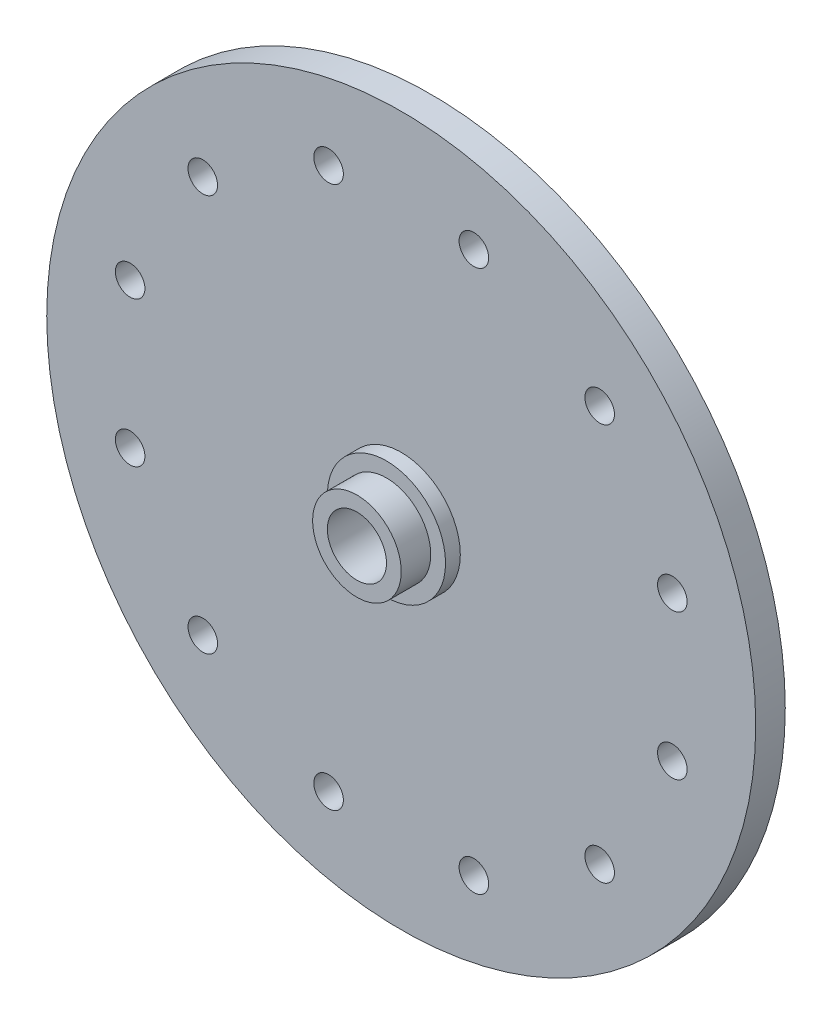
from build123d import *

# Parameters (mm, degrees)
SKETCH2_R           = 152.4
SKETCH2_R_2         = 12.7
BOSS_EXTRUDE1_DEPTH = 12.7
SKETCH3_R           = 6.35
CUT_EXTRUDE1_DEPTH  = 216.9
CRVPATTERN1_COUNT   = 12
SKETCH5_R           = 19.05
BOSS_EXTRUDE2_DEPTH = 19.05
SKETCH6_R           = 25.4
BOSS_EXTRUDE3_DEPTH = 6.35
SKETCH8_R           = 12.7
CUT_EXTRUDE2_DEPTH  = 218.85220334


with BuildPart() as part:
    # Sketch2 → Boss-Extrude1 (new body)
    with BuildSketch(Plane.XY):
        Circle(SKETCH2_R)
        Circle(SKETCH2_R_2, mode=Mode.SUBTRACT)
    extrude(amount=-BOSS_EXTRUDE1_DEPTH)

    # Sketch3 → Cut-Extrude1 (cut, through all)
    with BuildSketch(Plane.XY):
        with Locations((85.31243315, 85.31243315)):
            Circle(SKETCH3_R)
    cut_extrude1 = extrude(amount=-CUT_EXTRUDE1_DEPTH, mode=Mode.SUBTRACT)

    # CrvPattern1: Cut-Extrude1 ×12 about axis
    crvpattern1_axis = Axis((0, 0, 0), (0, 0, 1))
    for i in range(1, CRVPATTERN1_COUNT):
        add(cut_extrude1.rotate(crvpattern1_axis, i * 360 / CRVPATTERN1_COUNT), mode=Mode.SUBTRACT)

    # Sketch5 → Boss-Extrude2 (add)
    with BuildSketch(Plane.XY):
        with Locations(Location((0, 0, 0), (0, 0, 180))):
            Circle(SKETCH5_R)
    extrude(amount=BOSS_EXTRUDE2_DEPTH)

    # Sketch6 → Boss-Extrude3 (add)
    with BuildSketch(Plane.XY):
        Circle(SKETCH6_R)
    extrude(amount=BOSS_EXTRUDE3_DEPTH)

    # Sketch8 → Cut-Extrude2 (cut, through all)
    with BuildSketch(Plane(origin=(0, 0, -12.7), x_dir=(-1, 0, 0), z_dir=(0, 0, -1))):
        with Locations(Location((0, 0, 0), (0, 0, 180))):
            Circle(SKETCH8_R)
    extrude(amount=-CUT_EXTRUDE2_DEPTH, mode=Mode.SUBTRACT)


solid = part.part
